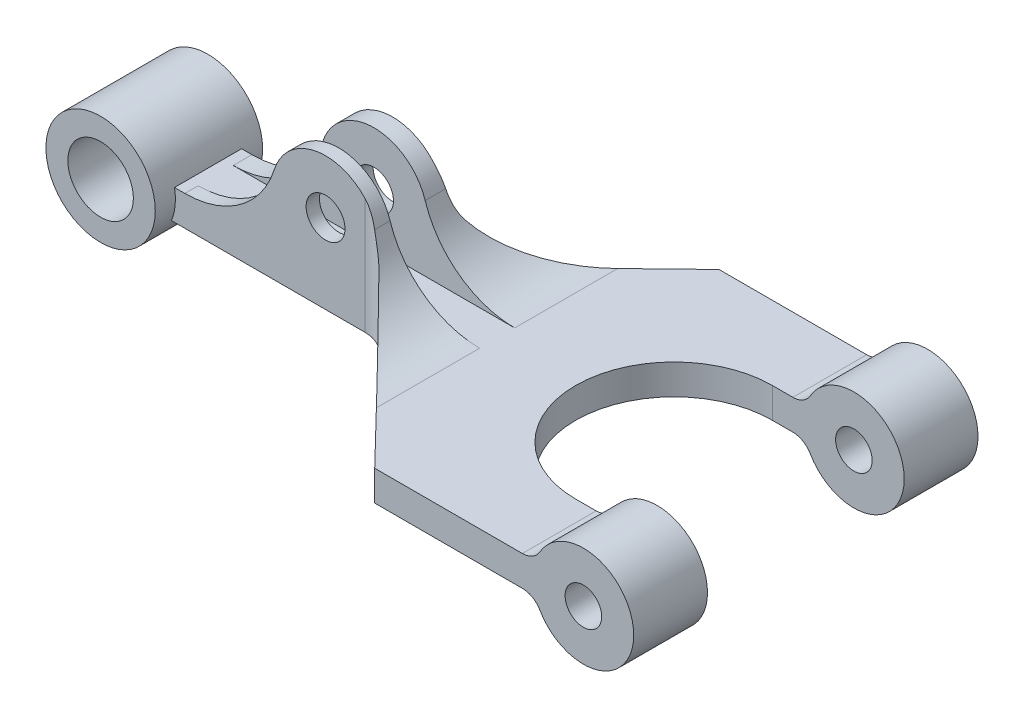
from build123d import *

# Parameters (mm, degrees)
SKETCH1_R           = 8
SKETCH1_R_2         = 2.9
EXTRUDE1_DEPTH      = 10
EXTRUDE2_DEPTH      = 0.5
EXTRUDE2_DEPTH_BACK = 4
SKETCH4_W           = 5.227994408
SKETCH4_H           = 18.151774592
CUT_EXTRUDE1_DEPTH  = 104.897653244
FILLET4_R           = 14
SKETCH6_R           = 7.5
SKETCH6_R_2         = 2.726604726
EXTRUDE4_DEPTH      = 11
EXTRUDE6_DEPTH      = 3
EXTRUDE6_DEPTH_BACK = 13
SKETCH11_R          = 8.15177363
SKETCH11_R_2        = 4.885123956
EXTRUDE7_START      = 11
SKETCH8_R           = 7.5
SKETCH8_R_2         = 2.725
EXTRUDE7_DEPTH      = 11
FILLET19_R          = 3
FILLET23_R          = 5


with BuildPart() as part:
    # Sketch1 → Extrude1 (new body)
    with BuildSketch(Plane.XY):
        with Locations((12.741128877, -63.13435232)):
            Circle(SKETCH1_R)
        with Locations((12.741128877, -63.13435232)):
            Circle(SKETCH1_R_2, mode=Mode.SUBTRACT)
    extrude(amount=-EXTRUDE1_DEPTH)

    # Sketch2 → Extrude2 (add, two sides: drawn at the far end of the back side and taken through both)
    with BuildSketch(Plane(origin=(0, -71, 0), x_dir=(-1, 0, 0), z_dir=(0, 1, 0)).offset(-EXTRUDE2_DEPTH_BACK)):
        with BuildLine():
            Line((-12.741128877, 0), (12.908426363, 0))
            Line((12.908426363, 0), (12.908426363, -10))
            Line((12.908426363, -10), (-12.741128877, -10))
            Line((-12.741128877, -10), (-20.741128877, -10))
            Line((-20.741128877, -10), (-41.392249983, -30))
            Line((-41.392249983, -30), (-65.343112489, -30))
            Line((-65.343112489, -30), (-65.343112489, -19))
            Line((-65.343112489, -19), (-60.343112489, -19))
            ThreePointArc((-60.343112489, -19), (-45.681392415, -4.338279927), (-60.343112489, 10.323440147))
            Line((-60.343112489, 10.323440147), (-65.343112489, 10.323440147))
            Line((-65.343112489, 10.323440147), (-65.343112489, 21.323440147))
            Line((-65.343112489, 21.323440147), (-41.392249983, 21.323440147))
            Line((-41.392249983, 21.323440147), (-20.741128877, 0))
            Line((-20.741128877, 0), (-12.741128877, 0))
        make_face()
    extrude(amount=EXTRUDE2_DEPTH + EXTRUDE2_DEPTH_BACK)

    # Sketch4 → Cut-Extrude1 (cut, through all)
    with BuildSketch(Plane(origin=(0, 0, 0), x_dir=(0, 0, -1), z_dir=(1, 0, 0))):
        with Locations((4.605888128, -61.424112704)):
            Rectangle(SKETCH4_W, SKETCH4_H)
    extrude(amount=CUT_EXTRUDE1_DEPTH, mode=Mode.SUBTRACT)

    # Fillet4
    fillet4_edges = [part.edges().sort_by_distance(p)[0] for p in [
        (9.619072783, -70.5, -0.995945462),
        (15.863184971, -70.5, -8.609942666),
        (15.863184971, -70.5, -0.995945462),
        (9.619072783, -70.5, -8.609942666),
    ]]
    fillet(fillet4_edges, radius=FILLET4_R)

    # Sketch6 → Extrude4 (add)
    with BuildSketch(Plane.XY.offset(21.323440147)):
        with Locations((72.497656499, -72.75)):
            Circle(SKETCH6_R)
        with Locations((72.497656499, -72.75)):
            Circle(SKETCH6_R_2, mode=Mode.SUBTRACT)
    extrude(amount=-EXTRUDE4_DEPTH)

    # Sketch11 → Extrude6 (add, two sides: drawn at the far end of the back side and taken through both)
    with BuildSketch(Plane.XY.offset(-EXTRUDE6_DEPTH_BACK)):
        with Locations((-17.793550319, -71.960171152)):
            Circle(SKETCH11_R)
        with Locations((-17.793550319, -71.960171152)):
            Circle(SKETCH11_R_2, mode=Mode.SUBTRACT)
    extrude(amount=EXTRUDE6_DEPTH + EXTRUDE6_DEPTH_BACK)

    # Sketch8 → Extrude7 (add)
    with BuildSketch(Plane.XY.offset(-30).offset(EXTRUDE7_START)):
        with Locations((72.497656499, -72.75)):
            Circle(SKETCH8_R)
        with Locations((72.497656499, -72.75)):
            Circle(SKETCH8_R_2, mode=Mode.SUBTRACT)
    extrude(amount=-EXTRUDE7_DEPTH)

    # Fillet19
    fillet19_edges = [part.edges().sort_by_distance(p)[0] for p in [
        (65.343112489, -75, 15.823440147),
        (65.343112489, -75, -24.5),
        (65.343112489, -70.5, 15.823440147),
        (65.343112489, -70.5, -24.5),
    ]]
    fillet(fillet19_edges, radius=FILLET19_R)

    # Fillet23
    fillet23_edges = [part.edges().sort_by_distance(p)[0] for p in [
        (20.741128877, -68.378111591, -10),
        (20.741128877, -68.378111591, 0),
    ]]
    fillet(fillet23_edges, radius=FILLET23_R)


solid = part.part
